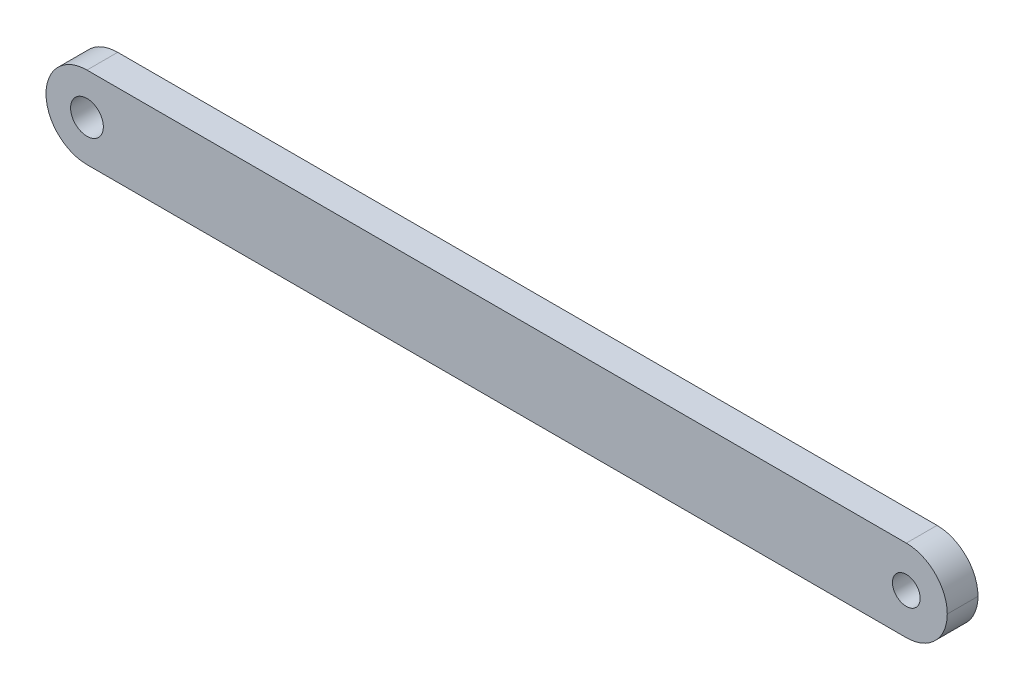
from build123d import *

# Parameters (mm, degrees)
SKETCH_1_R          = 1.354010502
EXTRUDE_1_DEPTH     = 3
SKETCH_2_R          = 1.6
CUT_EXTRUDE_1_DEPTH = 61.466769186


with BuildPart() as part:
    # 草图1 → 凸台-拉伸1 (new body)
    with BuildSketch(Plane(origin=(0, 0, 0), x_dir=(-1, 0, 0), z_dir=(0, 0, -1))):
        with BuildLine():
            Line((-55.860221974, 0), (24.13832066, 0))
            ThreePointArc((24.13832066, 0), (26.966394209, 1.171219344), (28.138320535, 3.999))
            ThreePointArc((28.138320535, 3.999), (26.96674766, 6.827427125), (24.138320535, 7.999))
            Line((24.138320535, 7.999), (-55.860222099, 7.999))
            ThreePointArc((-55.860222099, 7.999), (-58.688295648, 6.827780656), (-59.860221974, 4))
            ThreePointArc((-59.860221974, 4), (-58.688649099, 1.171572875), (-55.860221974, 0))
        make_face()
        with Locations((24.138809001, 3.998511534)):
            Circle(SKETCH_1_R, mode=Mode.SUBTRACT)
        with Locations((-55.859733508, 3.999511534)):
            Circle(SKETCH_1_R, mode=Mode.SUBTRACT)
    extrude(amount=-EXTRUDE_1_DEPTH)

    # 草图2 → 切除-拉伸1 (cut, through all)
    with BuildSketch(Plane.XY.offset(3)):
        with Locations((-24.138809001, 3.998511534)):
            Circle(SKETCH_2_R)
    extrude(amount=-CUT_EXTRUDE_1_DEPTH, mode=Mode.SUBTRACT)


solid = part.part
